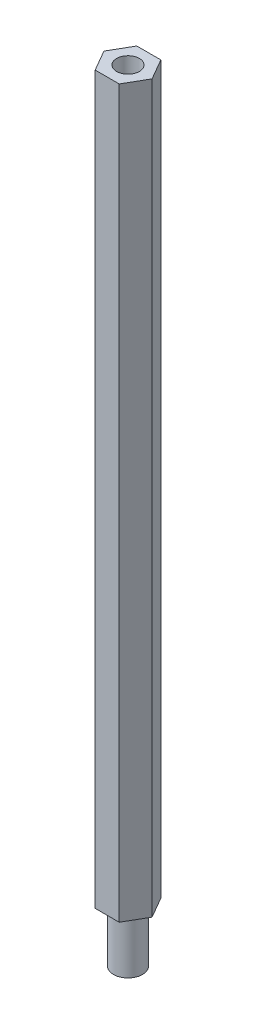
from build123d import *

# Parameters (mm, degrees)
EXTRUDE_1_DEPTH     = 80
SKETCH_6_R          = 1.6
EXTRUDE_2_DEPTH     = 6
SKETCH_7_R          = 1.25
CUT_EXTRUDE_1_DEPTH = 5


with BuildPart() as part:
    # 草图4 → 凸台-拉伸1 (new body)
    with BuildSketch(Plane(origin=(0, 0, 0), x_dir=(1, 0, 0), z_dir=(0, 1, 0))):
        Polygon((1.325, -2.29496732), (2.65, 0), (1.325, 2.29496732), (-1.325, 2.29496732), (-2.65, 0), (-1.325, -2.29496732), align=None)
    extrude(amount=EXTRUDE_1_DEPTH)

    # 草图6 → 凸台-拉伸2 (add)
    with BuildSketch(Plane(origin=(0, 0, 0), x_dir=(-1, 0, 0), z_dir=(0, -1, 0))):
        with Locations(Location((0, 0, 0), (0, 0, 270))):
            Circle(SKETCH_6_R)
    extrude(amount=EXTRUDE_2_DEPTH)

    # 草图7 → 切除-拉伸1 (cut)
    with BuildSketch(Plane(origin=(0, 80, 0), x_dir=(1, 0, 0), z_dir=(0, 1, 0))):
        with Locations(Location((0, 0, 0), (0, 0, 270))):
            Circle(SKETCH_7_R)
    extrude(amount=-CUT_EXTRUDE_1_DEPTH, mode=Mode.SUBTRACT)


solid = part.part
